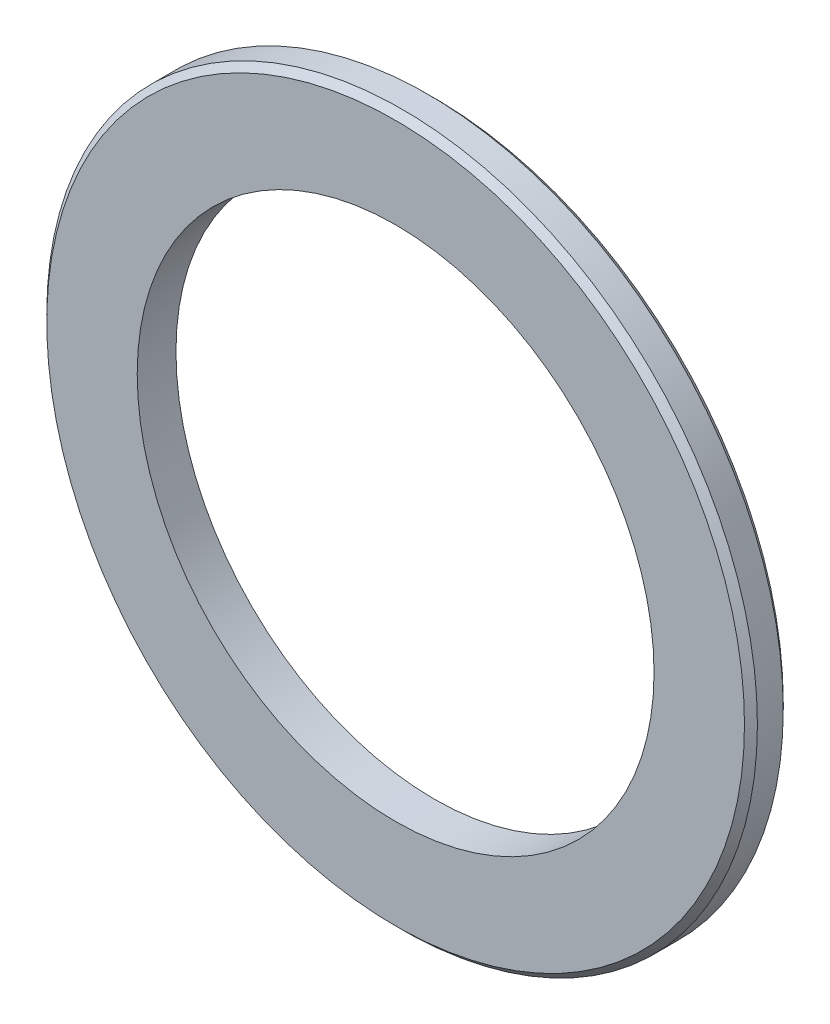
from build123d import *

# Parameters (mm, degrees)
SKETCH_1_R      = 27.5
SKETCH_1_R_2    = 20
EXTRUDE_1_DEPTH = 3
CHAMFER_1_SIZE  = 0.5


with BuildPart() as part:
    # Эскиз1 → Бобышка-Вытянуть1 (new body)
    with BuildSketch(Plane.XY):
        Circle(SKETCH_1_R)
        Circle(SKETCH_1_R_2, mode=Mode.SUBTRACT)
    extrude(amount=EXTRUDE_1_DEPTH)

    # Фаска1
    chamfer_1_edges = [part.edges().sort_by_distance(p)[0] for p in [
        (-27.5, 0, 0),
        (-27.5, 0, 3),
    ]]
    chamfer(chamfer_1_edges, length=CHAMFER_1_SIZE)


solid = part.part
